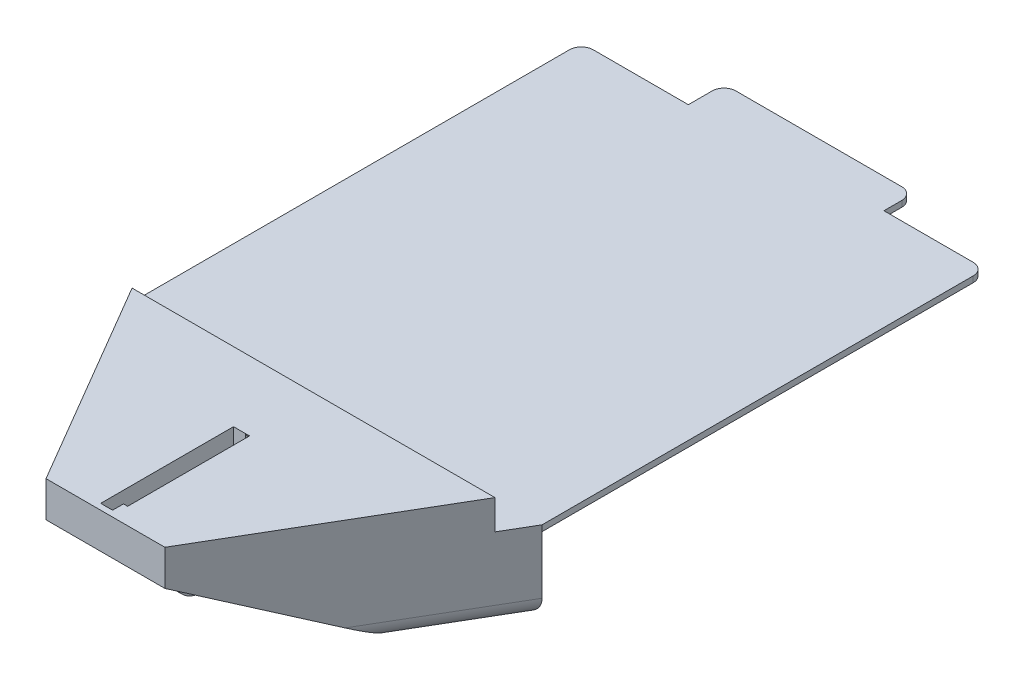
from build123d import *

# Parameters (mm, degrees)
BOSS_EXTRUDE1_DEPTH     = 7.7
SKETCH2_W               = 7
SKETCH2_H               = 3.1
CUT_EXTRUDE1_DEPTH      = 79.027559234
FILLET1_R               = 10
BOSS_EXTRUDE2_DEPTH     = 6
BOSS_EXTRUDE4_REACH     = 122.547
CUT_EXTRUDE2_DEPTH      = 121.437504541
CUT_EXTRUDE2_DEPTH_BACK = 121.437504541
CUT_EXTRUDE3_DEPTH      = 10
FILLET3_R               = 1
FILLET5_R               = 3
CUT_EXTRUDE4_REACH      = 123.217
SKETCH8_W               = 17
SKETCH8_H               = 5
SKETCH8_W_2             = 19
SKETCH8_H_2             = 7
FILLET6_R               = 2
FILLET7_R               = 2
BOSS_EXTRUDE5_DEPTH     = 2.5
FILLET8_R               = 5
SKETCH11_R              = 1
CUT_EXTRUDE5_DEPTH      = 0.7
SKETCH13_W              = 22.342383579
SKETCH13_H              = 4
CUT_EXTRUDE6_DEPTH      = 2
SKETCH14_W              = 66.9
SKETCH14_H              = 84.5
CUT_EXTRUDE8_DEPTH      = 5


with BuildPart() as part:
    # Sketch1 → Boss-Extrude1 (new body)
    with BuildSketch(Plane(origin=(0, 0, 0), x_dir=(1, 0, 0), z_dir=(0, 1, 0))):
        Polygon((0, 0), (-16.35, 0), (-16.35, -9.85), (-2.6, -9.85), (-2.6, -33), (-20.1, -33), (-20.1, -75), (0, -75), align=None)
    extrude(amount=BOSS_EXTRUDE1_DEPTH)

    # Sketch2 → Cut-Extrude1 (cut, through all)
    with BuildSketch(Plane.XY.offset(75)):
        with Locations((-16.6, 3.55)):
            Rectangle(SKETCH2_W, SKETCH2_H)
    extrude(amount=-CUT_EXTRUDE1_DEPTH, mode=Mode.SUBTRACT)

    # Fillet1
    fillet1_edges = [part.edges().sort_by_distance(p)[0] for p in [
        (-2.6, 3.85, 33),
    ]]
    fillet(fillet1_edges, radius=FILLET1_R)

    # Sketch3 → Boss-Extrude2 (add)
    with BuildSketch(Plane(origin=(0, 7.7, 0), x_dir=(1, 0, 0), z_dir=(0, 1, 0))):
        Polygon((0, 4.5), (-33.45, 4.5), (-33.45, -75), (-10, -115), (0, -115), align=None)
    extrude(amount=BOSS_EXTRUDE2_DEPTH)

    # Boss-Extrude4: up to this face of the body (flat: up to its plane)
    boss_extrude4_end = Plane(part.part.faces().sort_by_distance((0, 7.644090382, 47.331402086))[0])
    # Sketch5 → Boss-Extrude4 (add, up to the picked face)
    with BuildSketch(Plane.ZY.offset(33.45), mode=Mode.PRIVATE) as boss_extrude4_sk1:
        Polygon((75, 7.7), (75, -5), (90, -5), (115, 7.7), align=None)
    boss_extrude4_tool1 = split(extrude(boss_extrude4_sk1.sketch, amount=-BOSS_EXTRUDE4_REACH, mode=Mode.PRIVATE), bisect_by=boss_extrude4_end, keep=Keep.BOTH, mode=Mode.PRIVATE)
    add(boss_extrude4_tool1.solids().sort_by(Axis((-33.45, 2.312121, 89.69697), (1, 0, 0)))[0])

    # Sketch6 → Cut-Extrude2 (cut, two sides: drawn at the far end of the back side and taken through both)
    with BuildSketch(Plane(origin=(0, 7.7, 0), x_dir=(1, 0, 0), z_dir=(0, 1, 0)).offset(-CUT_EXTRUDE2_DEPTH_BACK)):
        Polygon((-33.45, -75), (-10, -115), (-33.45, -115), align=None)
    extrude(amount=CUT_EXTRUDE2_DEPTH + CUT_EXTRUDE2_DEPTH_BACK, mode=Mode.SUBTRACT)

    # Sketch7 → Cut-Extrude3 (cut)
    with BuildSketch(Plane(origin=(0, 0, 0), x_dir=(0, 0, -1), z_dir=(1, 0, 0))):
        Polygon((-75, 0), (-82, 0), (-80, -5), (-75, -5), align=None)
    extrude(amount=-CUT_EXTRUDE3_DEPTH, mode=Mode.SUBTRACT)

    # Fillet3
    fillet3_edges = [part.edges().sort_by_distance(p)[0] for p in [
        (-10, -5, 77.5),
        (-5, -5, 80),
    ]]
    fillet(fillet3_edges, radius=FILLET3_R)

    # Mirror1: part across plane


with BuildPart() as part_1:
    add(part.part)
    add(part.part.mirror(Plane(origin=(0, 7.7, 75), x_dir=(0, 0, 1), z_dir=(-1, 0, 0))))

    # Fillet5
    fillet5_edges = [part_1.edges().sort_by_distance(p)[0] for p in [
        (-29.053125, -5, 82.5),
        (29.053125, -5, 82.5),
    ]]
    fillet(fillet5_edges, radius=FILLET5_R)

    # Cut-Extrude4: up to this face of the body (flat: up to its plane)
    cut_extrude4_end = Plane(part_1.part.faces().sort_by_distance((0, 0, 46.525100135))[0])
    # Sketch8 → Cut-Extrude4 (cut, up to the picked face)
    with BuildSketch(Plane(origin=(0, 13.7, 0), x_dir=(1, 0, 0), z_dir=(0, 1, 0)), mode=Mode.PRIVATE) as cut_extrude4_sk1:
        with Locations((24.95, 2)):
            Rectangle(SKETCH8_W, SKETCH8_H)
    cut_extrude4_tool1 = split(extrude(cut_extrude4_sk1.sketch, amount=-CUT_EXTRUDE4_REACH, mode=Mode.PRIVATE), bisect_by=cut_extrude4_end, keep=Keep.BOTH, mode=Mode.PRIVATE)
    # Sketch8 → Cut-Extrude4 (cut, up to the picked face)
    with BuildSketch(Plane(origin=(0, 13.7, 0), x_dir=(1, 0, 0), z_dir=(0, 1, 0)), mode=Mode.PRIVATE) as cut_extrude4_sk2:
        with Locations((-24.95, 2)):
            Rectangle(SKETCH8_W_2, SKETCH8_H_2)
    cut_extrude4_tool2 = split(extrude(cut_extrude4_sk2.sketch, amount=-CUT_EXTRUDE4_REACH, mode=Mode.PRIVATE), bisect_by=cut_extrude4_end, keep=Keep.BOTH, mode=Mode.PRIVATE)
    add(cut_extrude4_tool1.solids().sort_by(Axis((24.95, 13.7, -2), (0, -1, 0)))[0], mode=Mode.SUBTRACT)
    add(cut_extrude4_tool2.solids().sort_by(Axis((-24.95, 13.7, -2), (0, -1, 0)))[0], mode=Mode.SUBTRACT)

    # Fillet6
    fillet6_edges = [part_1.edges().sort_by_distance(p)[0] for p in [
        (-15.45, 10.7, -4.5),
        (-33.45, 10.7, 1.5),
    ]]
    fillet(fillet6_edges, radius=FILLET6_R)

    # Fillet7
    fillet7_edges = [part_1.edges().sort_by_distance(p)[0] for p in [
        (33.45, 10.7, 0.5),
        (16.45, 10.7, -4.5),
    ]]
    fillet(fillet7_edges, radius=FILLET7_R)

    # Sketch12 → Boss-Extrude5 (add, symmetric)
    with BuildSketch(Plane.ZY.offset(-0.2)):
        Polygon((93.346456693, -3.3), (108.972772013, 4.638168182), (104.121669234, -3.3), align=None)
    extrude(amount=BOSS_EXTRUDE5_DEPTH, both=True)

    # Fillet8
    fillet8_edges = [part_1.edges().sort_by_distance(p)[0] for p in [
        (0.2, -3.3, 104.121669234),
    ]]
    fillet(fillet8_edges, radius=FILLET8_R)

    # Sketch11 → Cut-Extrude5 (cut)
    with BuildSketch(Plane.ZY.offset(-0.2)):
        with Locations((82.490949754, -1.3)):
            Circle(SKETCH11_R)
        with Locations((103, -1.3)):
            Circle(SKETCH11_R)
        Polygon((82.490949754, -1.3), (103, -1.3), (114, 16.7), (93.490949754, 16.7), align=None)
        with BuildLine():
            Line((83.490949754, -1.3), (82.490949754, -1.3))
            Line((82.490949754, -1.3), (83.012399764, -0.446718166))
            ThreePointArc((83.012399764, -0.446718166), (81.618754246, -1.789157434), (83.490949754, -1.3))
        make_face()
        with BuildLine():
            Line((83.012399764, -0.446718166), (82.490949754, -1.3))
            Line((82.490949754, -1.3), (83.490949754, -1.3))
            ThreePointArc((83.490949754, -1.3), (83.363145263, -0.810842566), (83.012399764, -0.446718166))
        make_face()
        with BuildLine():
            ThreePointArc((103.521450009, -0.446718166), (102.510842566, -0.427804492), (102, -1.3))
            Line((102, -1.3), (103, -1.3))
            Line((103, -1.3), (103.521450009, -0.446718166))
        make_face()
        with BuildLine():
            Line((103, -1.3), (102, -1.3))
            ThreePointArc((102, -1.3), (103, -2.3), (104, -1.3))
            ThreePointArc((104, -1.3), (103.872195508, -0.810842566), (103.521450009, -0.446718166))
            Line((103.521450009, -0.446718166), (103, -1.3))
        make_face()
    extrude(amount=-CUT_EXTRUDE5_DEPTH, mode=Mode.SUBTRACT)

    # Sketch13 → Cut-Extrude6 (cut)
    with BuildSketch(Plane.ZY.offset(-0.2)):
        with Locations((102.828808211, 11.7)):
            Rectangle(SKETCH13_W, SKETCH13_H)
    extrude(amount=CUT_EXTRUDE6_DEPTH, mode=Mode.SUBTRACT)

    # Sketch14 → Cut-Extrude8 (cut)
    with BuildSketch(Plane(origin=(0, 13.7, 0), x_dir=(1, 0, 0), z_dir=(0, 1, 0))):
        with Locations((0, -37.75)):
            Rectangle(SKETCH14_W, SKETCH14_H)
    extrude(amount=-CUT_EXTRUDE8_DEPTH, mode=Mode.SUBTRACT)


solid = part_1.part
